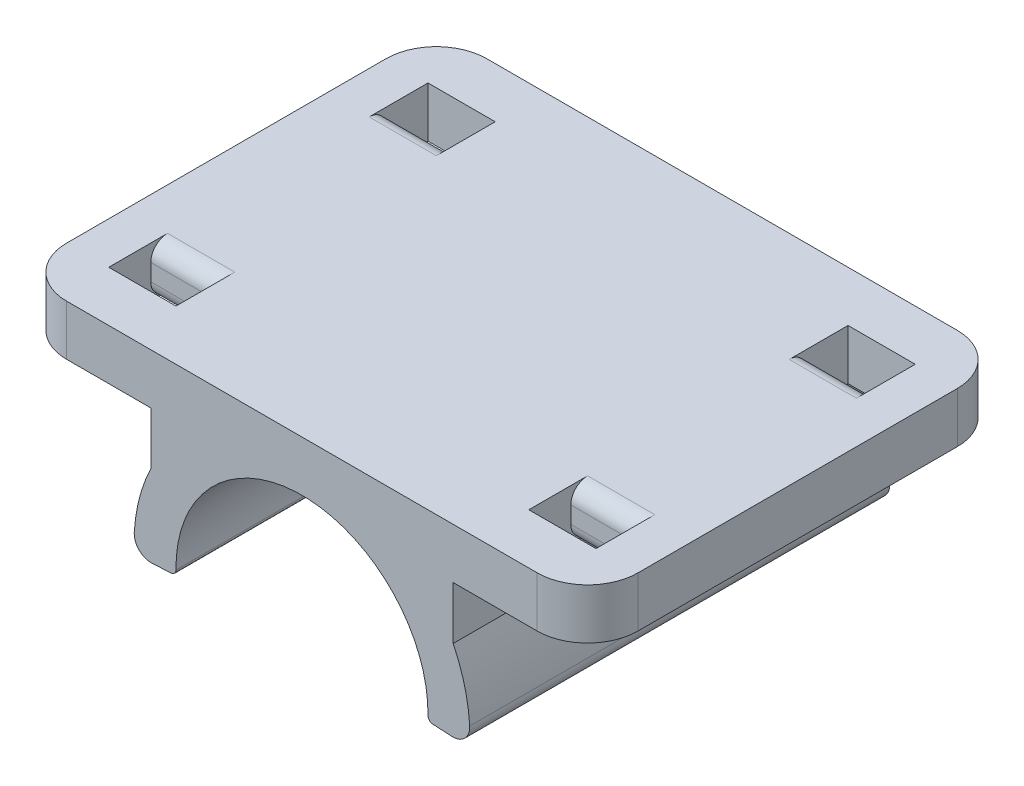
from build123d import *

# Parameters (mm, degrees)
RESSALTO_EXTRUS_O1_DEPTH = 25
FILETE1_R                = 1
CORTE_EXTRUS_O1_REACH    = 34.161
ESBO_O3_W                = 4
ESBO_O3_H                = 2.5
FILETE2_R                = 1
FILETE3_R                = 3


with BuildPart() as part:
    # Esboço1 → Ressalto-extrusão1 (new body)
    with BuildSketch(Plane.XY):
        with BuildLine():
            Line((-17, 10.5), (17, 10.5))
            Line((17, 10.5), (17, 7.5))
            Line((17, 7.5), (9, 7.5))
            Line((9, 7.5), (9, 4.358898944))
            ThreePointArc((9, 4.358898944), (9.801987798, 1.980160401), (9.986295348, -0.523359562))
            Line((9.986295348, -0.523359562), (7.783546915, -0.407918409))
            ThreePointArc((7.783546915, -0.407918409), (7.580206581, -0.313319761), (7.499276636, -0.104163027))
            ThreePointArc((7.499276636, -0.104163027), (0, 7.5), (-7.499276636, -0.104163027))
            ThreePointArc((-7.499276636, -0.104163027), (-7.580206581, -0.313319761), (-7.783546915, -0.407918409))
            Line((-7.783546915, -0.407918409), (-9.986295348, -0.523359562))
            ThreePointArc((-9.986295348, -0.523359562), (-9.801987798, 1.980160401), (-9, 4.358898944))
            Line((-9, 4.358898944), (-9, 7.5))
            Line((-9, 7.5), (-17, 7.5))
            Line((-17, 7.5), (-17, 10.5))
        make_face()
    extrude(amount=RESSALTO_EXTRUS_O1_DEPTH)

    # Filete1
    filete1_edges = [part.edges().sort_by_distance(p)[0] for p in [
        (-9.986295348, -0.523359562, 12.5),
        (9.986295348, -0.523359562, 12.5),
    ]]
    fillet(filete1_edges, radius=FILETE1_R)

    # Esboço3 → Corte-extrusão1 (cut, up to next)
    with BuildSketch(Plane(origin=(0, 10.5, 0), x_dir=(1, 0, 0), z_dir=(0, 1, 0)), mode=Mode.PRIVATE) as corte_extrus_o1_sk1:
        with Locations((-12.5, -4.25)):
            Rectangle(ESBO_O3_W, ESBO_O3_H)
    corte_extrus_o1_tool1 = extrude(corte_extrus_o1_sk1.sketch, amount=-CORTE_EXTRUS_O1_REACH, mode=Mode.PRIVATE) & part.part
    # Esboço3 → Corte-extrusão1 (cut, up to next)
    with BuildSketch(Plane(origin=(0, 10.5, 0), x_dir=(1, 0, 0), z_dir=(0, 1, 0)), mode=Mode.PRIVATE) as corte_extrus_o1_sk2:
        with Locations((-12.5, -20.75)):
            Rectangle(ESBO_O3_W, ESBO_O3_H)
    corte_extrus_o1_tool2 = extrude(corte_extrus_o1_sk2.sketch, amount=-CORTE_EXTRUS_O1_REACH, mode=Mode.PRIVATE) & part.part
    # Esboço3 → Corte-extrusão1 (cut, up to next)
    with BuildSketch(Plane(origin=(0, 10.5, 0), x_dir=(1, 0, 0), z_dir=(0, 1, 0)), mode=Mode.PRIVATE) as corte_extrus_o1_sk3:
        with Locations((12.5, -20.75)):
            Rectangle(ESBO_O3_W, ESBO_O3_H)
    corte_extrus_o1_tool3 = extrude(corte_extrus_o1_sk3.sketch, amount=-CORTE_EXTRUS_O1_REACH, mode=Mode.PRIVATE) & part.part
    # Esboço3 → Corte-extrusão1 (cut, up to next)
    with BuildSketch(Plane(origin=(0, 10.5, 0), x_dir=(1, 0, 0), z_dir=(0, 1, 0)), mode=Mode.PRIVATE) as corte_extrus_o1_sk4:
        with Locations((12.5, -4.25)):
            Rectangle(ESBO_O3_W, ESBO_O3_H)
    corte_extrus_o1_tool4 = extrude(corte_extrus_o1_sk4.sketch, amount=-CORTE_EXTRUS_O1_REACH, mode=Mode.PRIVATE) & part.part
    add(corte_extrus_o1_tool1.solids().sort_by_distance((-12.5, 10.5, 4.25))[0], mode=Mode.SUBTRACT)
    add(corte_extrus_o1_tool2.solids().sort_by_distance((-12.5, 10.5, 20.75))[0], mode=Mode.SUBTRACT)
    add(corte_extrus_o1_tool3.solids().sort_by_distance((12.5, 10.5, 20.75))[0], mode=Mode.SUBTRACT)
    add(corte_extrus_o1_tool4.solids().sort_by_distance((12.5, 10.5, 4.25))[0], mode=Mode.SUBTRACT)

    # Filete2
    filete2_edges = [part.edges().sort_by_distance(p)[0] for p in [
        (12.5, 10.5, 5.5),
        (12.5, 7.5, 5.5),
        (12.5, 10.5, 19.5),
        (12.5, 7.5, 19.5),
        (-12.5, 10.5, 19.5),
        (-12.5, 7.5, 19.5),
        (-12.5, 10.5, 5.5),
        (-12.5, 7.5, 5.5),
    ]]
    fillet(filete2_edges, radius=FILETE2_R)

    # Filete3
    filete3_edges = [part.edges().sort_by_distance(p)[0] for p in [
        (-17, 9, 0),
        (17, 9, 0),
        (17, 9, 25),
        (-17, 9, 25),
    ]]
    fillet(filete3_edges, radius=FILETE3_R)


solid = part.part
